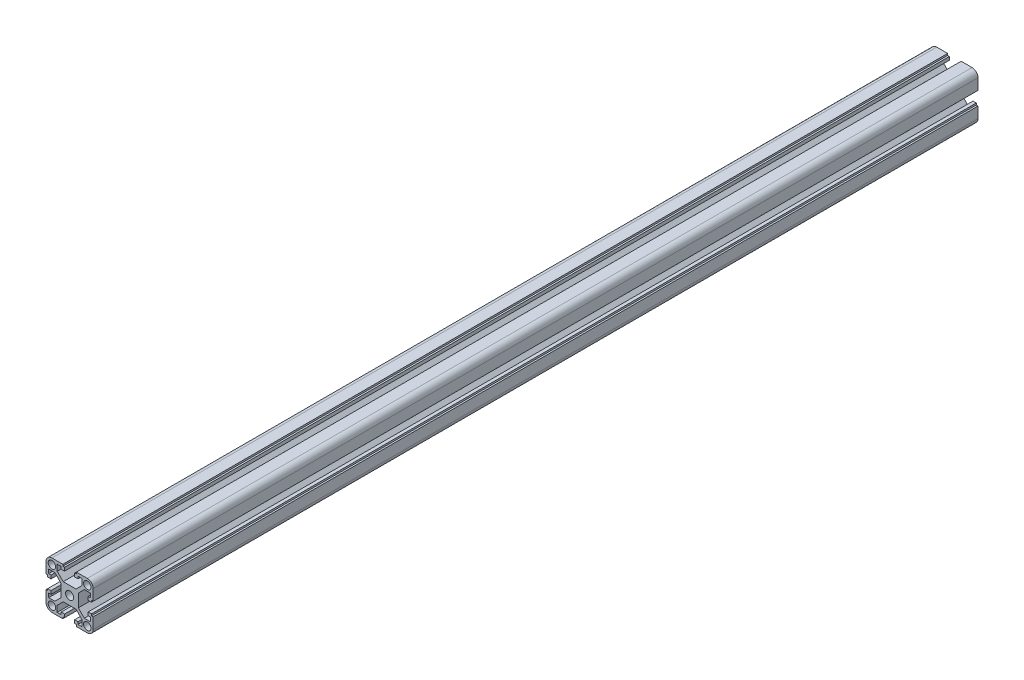
from build123d import *

# Parameters (mm, degrees)
SKETCH_1_R      = 3.4
SKETCH_1_R_2    = 3.15
EXTRUDE_1_DEPTH = 375


with BuildPart() as part:
    # Эскиз1 → Бобышка-Вытянуть1 (new, symmetric)
    with BuildSketch(Plane.XY):
        with BuildLine():
            Line((-15, 20), (-5.727351849, 20))
            Line((-5.727351849, 20), (-5.727351849, 18.530416438))
            Line((-5.727351849, 18.530416438), (-4.25, 18.530416438))
            Line((-4.25, 18.530416438), (-4.25, 15.732027397))
            Line((-4.25, 15.732027397), (-7.111831817, 15.732027397))
            Line((-7.111831817, 15.732027397), (-7.111831817, 17.7))
            Line((-7.111831817, 17.7), (-10.5, 17.7))
            Line((-10.5, 17.7), (-10.5, 12.479898987))
            Line((-10.5, 12.479898987), (-5.420101013, 7.4))
            Line((-5.420101013, 7.4), (5.420101013, 7.4))
            Line((5.420101013, 7.4), (10.5, 12.479898987))
            Line((10.5, 12.479898987), (10.5, 17.7))
            Line((10.5, 17.7), (7.111831817, 17.7))
            Line((7.111831817, 17.7), (7.111831817, 15.732027397))
            Line((7.111831817, 15.732027397), (4.25, 15.732027397))
            Line((4.25, 15.732027397), (4.25, 18.530416438))
            Line((4.25, 18.530416438), (5.727351849, 18.530416438))
            Line((5.727351849, 18.530416438), (5.727351849, 20))
            Line((5.727351849, 20), (15, 20))
            ThreePointArc((15, 20), (18.535533906, 18.535533906), (20, 15))
            Line((20, 15), (20, 5.727351849))
            Line((20, 5.727351849), (18.530416438, 5.727351849))
            Line((18.530416438, 5.727351849), (18.530416438, 4.25))
            Line((18.530416438, 4.25), (15.732027397, 4.25))
            Line((15.732027397, 4.25), (15.732027397, 7.111831817))
            Line((15.732027397, 7.111831817), (17.7, 7.111831817))
            Line((17.7, 7.111831817), (17.7, 10.5))
            Line((17.7, 10.5), (12.479898987, 10.5))
            Line((12.479898987, 10.5), (7.4, 5.420101013))
            Line((7.4, 5.420101013), (7.4, -5.420101013))
            Line((7.4, -5.420101013), (12.479898987, -10.5))
            Line((12.479898987, -10.5), (17.7, -10.5))
            Line((17.7, -10.5), (17.7, -7.111831817))
            Line((17.7, -7.111831817), (15.732027397, -7.111831817))
            Line((15.732027397, -7.111831817), (15.732027397, -4.25))
            Line((15.732027397, -4.25), (18.530416438, -4.25))
            Line((18.530416438, -4.25), (18.530416438, -5.727351849))
            Line((18.530416438, -5.727351849), (20, -5.727351849))
            Line((20, -5.727351849), (20, -15))
            ThreePointArc((20, -15), (18.535533906, -18.535533906), (15, -20))
            Line((15, -20), (5.727351849, -20))
            Line((5.727351849, -20), (5.727351849, -18.530416438))
            Line((5.727351849, -18.530416438), (4.25, -18.530416438))
            Line((4.25, -18.530416438), (4.25, -15.732027397))
            Line((4.25, -15.732027397), (7.111831817, -15.732027397))
            Line((7.111831817, -15.732027397), (7.111831817, -17.7))
            Line((7.111831817, -17.7), (10.5, -17.7))
            Line((10.5, -17.7), (10.5, -12.479898987))
            Line((10.5, -12.479898987), (5.420101013, -7.4))
            Line((5.420101013, -7.4), (-5.420101013, -7.4))
            Line((-5.420101013, -7.4), (-10.5, -12.479898987))
            Line((-10.5, -12.479898987), (-10.5, -17.7))
            Line((-10.5, -17.7), (-7.111831817, -17.7))
            Line((-7.111831817, -17.7), (-7.111831817, -15.732027397))
            Line((-7.111831817, -15.732027397), (-4.25, -15.732027397))
            Line((-4.25, -15.732027397), (-4.25, -18.530416438))
            Line((-4.25, -18.530416438), (-5.727351849, -18.530416438))
            Line((-5.727351849, -18.530416438), (-5.727351849, -20))
            Line((-5.727351849, -20), (-15, -20))
            ThreePointArc((-15, -20), (-18.535533906, -18.535533906), (-20, -15))
            Line((-20, -15), (-20, -5.727351849))
            Line((-20, -5.727351849), (-18.530416438, -5.727351849))
            Line((-18.530416438, -5.727351849), (-18.530416438, -4.25))
            Line((-18.530416438, -4.25), (-15.732027397, -4.25))
            Line((-15.732027397, -4.25), (-15.732027397, -7.111831817))
            Line((-15.732027397, -7.111831817), (-17.7, -7.111831817))
            Line((-17.7, -7.111831817), (-17.7, -10.5))
            Line((-17.7, -10.5), (-12.479898987, -10.5))
            Line((-12.479898987, -10.5), (-7.4, -5.420101013))
            Line((-7.4, -5.420101013), (-7.4, 5.420101013))
            Line((-7.4, 5.420101013), (-12.479898987, 10.5))
            Line((-12.479898987, 10.5), (-17.7, 10.5))
            Line((-17.7, 10.5), (-17.7, 7.111831817))
            Line((-17.7, 7.111831817), (-15.732027397, 7.111831817))
            Line((-15.732027397, 7.111831817), (-15.732027397, 4.25))
            Line((-15.732027397, 4.25), (-18.530416438, 4.25))
            Line((-18.530416438, 4.25), (-18.530416438, 5.727351849))
            Line((-18.530416438, 5.727351849), (-20, 5.727351849))
            Line((-20, 5.727351849), (-20, 15))
            ThreePointArc((-20, 15), (-18.535533906, 18.535533906), (-15, 20))
        make_face()
        Circle(SKETCH_1_R, mode=Mode.SUBTRACT)
        with Locations((-15, 15)):
            Circle(SKETCH_1_R_2, mode=Mode.SUBTRACT)
        with Locations((15, 15)):
            Circle(SKETCH_1_R_2, mode=Mode.SUBTRACT)
        with Locations((15, -15)):
            Circle(SKETCH_1_R_2, mode=Mode.SUBTRACT)
        with Locations((-15, -15)):
            Circle(SKETCH_1_R_2, mode=Mode.SUBTRACT)
    extrude(amount=EXTRUDE_1_DEPTH, both=True)


solid = part.part
